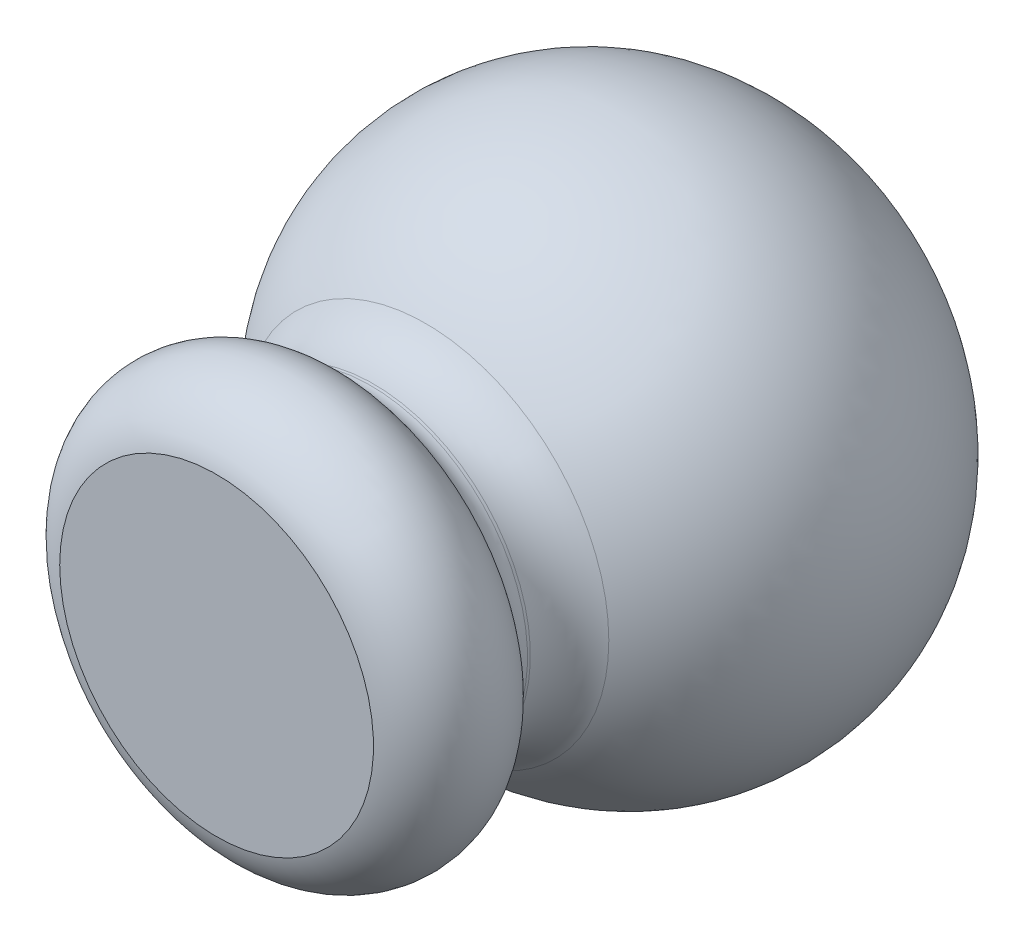
from build123d import *


with BuildPart() as part:
    # Эскиз1 → Повернуть2 (revolve)
    with BuildSketch(Plane(origin=(0, 0, 0), x_dir=(1, 0, 0), z_dir=(0, 1, 0))):
        with BuildLine():
            Line((-3, -8), (-3, -8.054381717))
            ThreePointArc((-3, -8.054381717), (-3.073746154, -8.315739055), (-3.273230633, -8.5))
            ThreePointArc((-3.273230633, -8.5), (-4, -9.844361258), (-3, -11))
            Line((-3, -11), (0, -11))
            Line((0, -11), (0, -7))
            Line((0, -7), (-1.2, -7))
            Line((-1.2, -7), (-1.2, 0))
            Line((-1.2, 0), (-3.5, 0))
            ThreePointArc((-3.5, 0), (-5.25, -3.5), (-3.5, -7))
            ThreePointArc((-3.5, -7), (-3.131966011, -7.440983006), (-3, -8))
        make_face()
    revolve(axis=Axis((0, 0, 0), (0, 0, 1)))


solid = part.part
